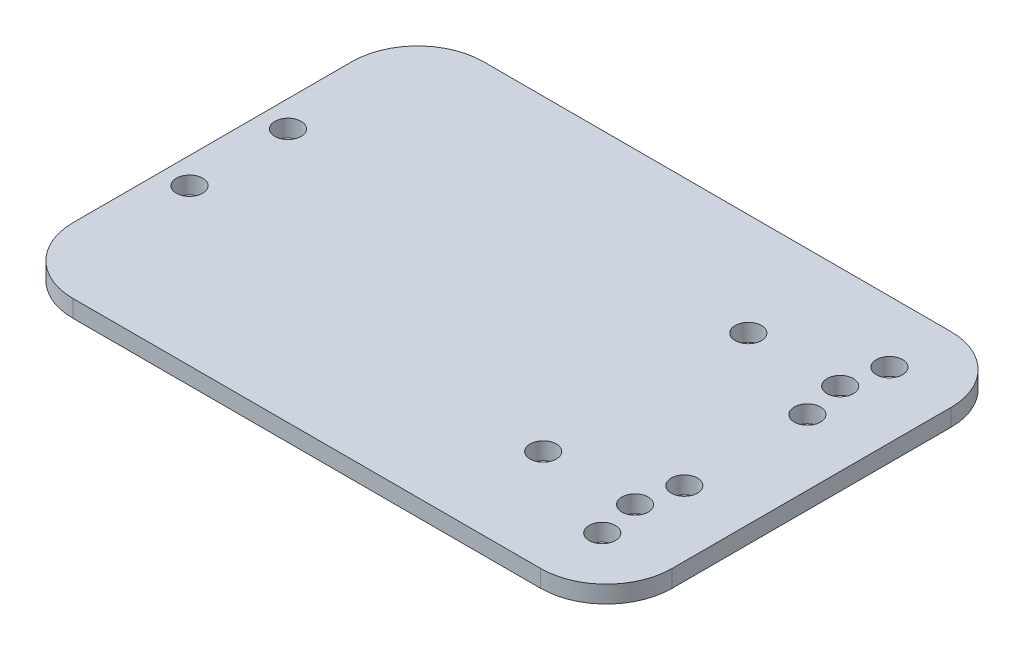
from build123d import *

# Parameters (mm, degrees)
SKETCH_1_W          = 73
SKETCH_1_H          = 50
EXTRUDE_1_DEPTH     = 2.1
SKETCH_2_R          = 1.6
CUT_EXTRUDE_1_DEPTH = 2.1
SKETCH_3_R          = 1.6
CUT_EXTRUDE_2_DEPTH = 2.1
SKETCH_4_R          = 1.6
CUT_EXTRUDE_3_DEPTH = 2.1
FILLET_1_R          = 8


with BuildPart() as part:
    # 草图1 → 凸台-拉伸1 (new body)
    with BuildSketch(Plane(origin=(0, 0, 0), x_dir=(1, 0, 0), z_dir=(0, 1, 0))):
        Rectangle(SKETCH_1_W, SKETCH_1_H)
    extrude(amount=EXTRUDE_1_DEPTH)

    # 草图2 → 切除-拉伸1 (cut)
    with BuildSketch(Plane(origin=(0, 2.1, 0), x_dir=(1, 0, 0), z_dir=(0, 1, 0))):
        with Locations(Location((-33.3, 6, 0), (0, 0, 270))):
            Circle(SKETCH_2_R)
        with Locations(Location((-33.3, -6, 0), (0, 0, 270))):
            Circle(SKETCH_2_R)
    extrude(amount=-CUT_EXTRUDE_1_DEPTH, mode=Mode.SUBTRACT)

    # 草图3 → 切除-拉伸2 (cut)
    with BuildSketch(Plane(origin=(0, 2.1, 0), x_dir=(1, 0, 0), z_dir=(0, 1, 0))):
        with Locations(Location((28.5, 17.5, 0), (0, 0, 270))):
            Circle(SKETCH_3_R)
        with Locations(Location((28.5, 7.5, 0), (0, 0, 270))):
            Circle(SKETCH_3_R)
        with Locations(Location((28.5, -7.5, 0), (0, 0, 270))):
            Circle(SKETCH_3_R)
        with Locations(Location((28.5, -17.5, 0), (0, 0, 270))):
            Circle(SKETCH_3_R)
    extrude(amount=-CUT_EXTRUDE_2_DEPTH, mode=Mode.SUBTRACT)

    # 草图4 → 切除-拉伸3 (cut)
    with BuildSketch(Plane(origin=(0, 2.1, 0), x_dir=(1, 0, 0), z_dir=(0, 1, 0))):
        with Locations(Location((16.3, 12.5, 0), (0, 0, 270))):
            Circle(SKETCH_4_R)
        with Locations(Location((16.3, -12.5, 0), (0, 0, 270))):
            Circle(SKETCH_4_R)
        with Locations(Location((27.5, 12.5, 0), (0, 0, 270))):
            Circle(SKETCH_4_R)
        with Locations(Location((27.5, -12.5, 0), (0, 0, 270))):
            Circle(SKETCH_4_R)
    extrude(amount=-CUT_EXTRUDE_3_DEPTH, mode=Mode.SUBTRACT)

    # 圆角1
    fillet_1_edges = [part.edges().sort_by_distance(p)[0] for p in [
        (36.5, 1.05, 25),
        (-36.5, 1.05, 25),
        (-36.5, 1.05, -25),
        (36.5, 1.05, -25),
    ]]
    fillet(fillet_1_edges, radius=FILLET_1_R)


solid = part.part
